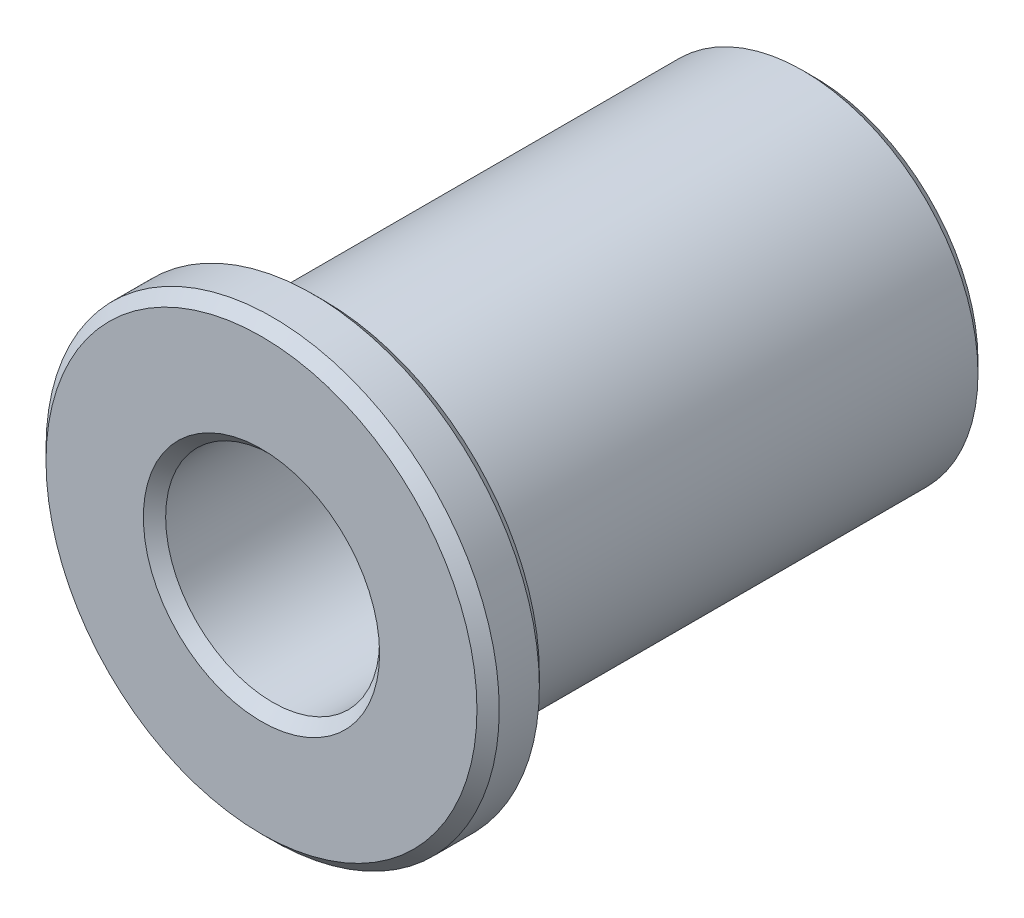
from build123d import *

# Parameters (mm, degrees)
SKETCH1_R           = 3.925
BOSS_EXTRUDE1_DEPTH = 11
SKETCH2_R           = 5.084149635
BOSS_EXTRUDE2_DEPTH = 1.4
SKETCH3_R           = 2.4
CUT_EXTRUDE1_DEPTH  = 15.333776719
CHAMFER1_SIZE       = 0.25


with BuildPart() as part:
    # Sketch1 → Boss-Extrude1 (new body)
    with BuildSketch(Plane.XY):
        Circle(SKETCH1_R)
    extrude(amount=-BOSS_EXTRUDE1_DEPTH)

    # Sketch2 → Boss-Extrude2 (add)
    with BuildSketch(Plane.XY):
        Circle(SKETCH2_R)
    extrude(amount=BOSS_EXTRUDE2_DEPTH)

    # Sketch3 → Cut-Extrude1 (cut, through all)
    with BuildSketch(Plane.XY.offset(1.4)):
        Circle(SKETCH3_R)
    extrude(amount=-CUT_EXTRUDE1_DEPTH, mode=Mode.SUBTRACT)

    # Chamfer1
    chamfer1_edges = [part.edges().sort_by_distance(p)[0] for p in [
        (-2.4, 0, -11),
        (-2.4, 0, 1.4),
        (-3.925, 0, -11),
        (-5.084149635, 0, 0),
        (-5.084149635, 0, 1.4),
    ]]
    chamfer(chamfer1_edges, length=CHAMFER1_SIZE)


solid = part.part
